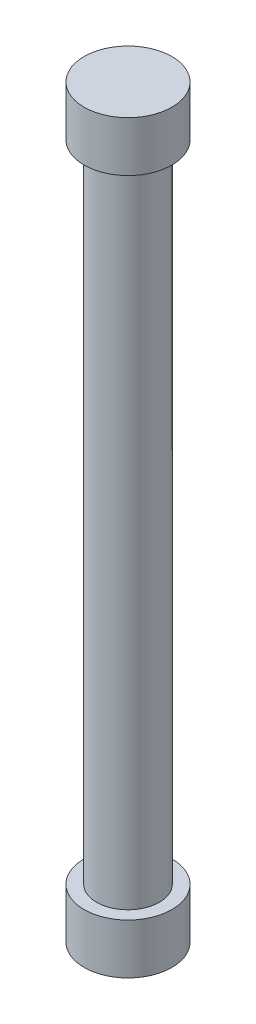
from build123d import *

# Parameters (mm, degrees)
SKETCH1_R           = 2.5
BOSS_EXTRUDE1_DEPTH = 51.4
SKETCH2_R           = 3.5
BOSS_EXTRUDE2_DEPTH = 4
BOSS_EXTRUDE3_START = 4
SKETCH3_R           = 3.5
BOSS_EXTRUDE3_DEPTH = 4


with BuildPart() as part:
    # Sketch1 → Boss-Extrude1 (new body)
    with BuildSketch(Plane(origin=(0, 0, 0), x_dir=(1, 0, 0), z_dir=(0, 1, 0))):
        with Locations(Location((0, 0, 0), (0, 0, 90))):
            Circle(SKETCH1_R)
    extrude(amount=BOSS_EXTRUDE1_DEPTH)

    # Sketch2 → Boss-Extrude2 (add)
    with BuildSketch(Plane(origin=(0, 51.4, 0), x_dir=(1, 0, 0), z_dir=(0, 1, 0))):
        with Locations(Location((0, 0, 0), (0, 0, 270))):
            Circle(SKETCH2_R)
    extrude(amount=BOSS_EXTRUDE2_DEPTH)

    # Sketch3 → Boss-Extrude3 (add)
    with BuildSketch(Plane.XZ.offset(BOSS_EXTRUDE3_START)):
        with Locations(Location((0, 0, 0), (0, 0, 90))):
            Circle(SKETCH3_R)
    extrude(amount=-BOSS_EXTRUDE3_DEPTH)


solid = part.part
